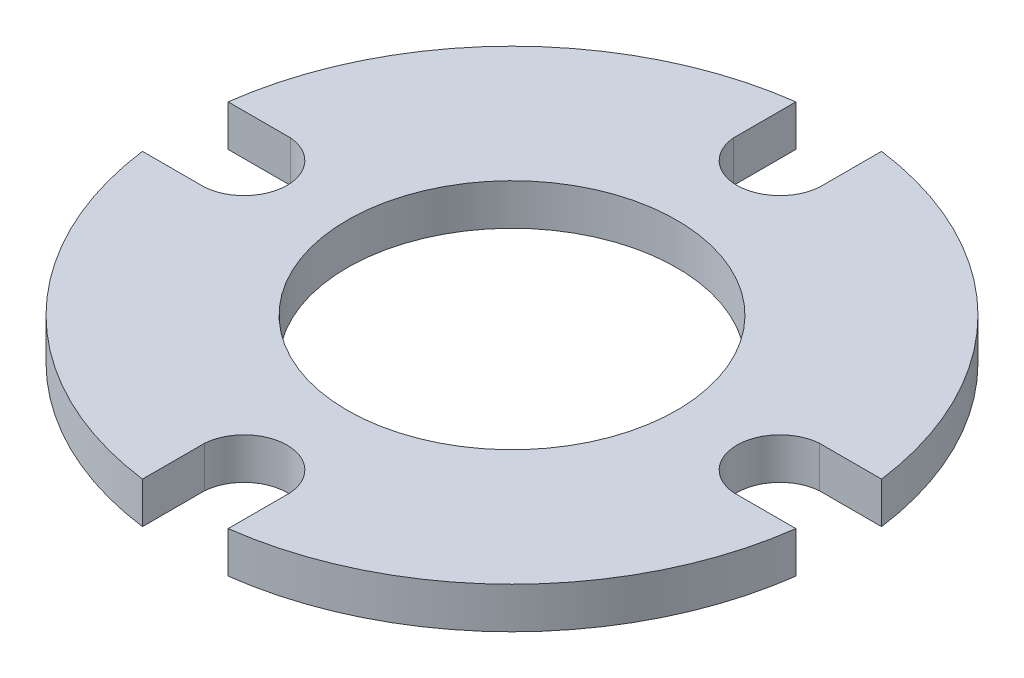
from build123d import *

# Parameters (mm, degrees)
SKETCH1_R           = 0.5
BOSS_EXTRUDE1_DEPTH = 0.125


with BuildPart() as part:
    # Sketch1 → Boss-Extrude1 (new body)
    with BuildSketch(Plane(origin=(0, 0, 0), x_dir=(1, 0, 0), z_dir=(0, 1, 0))):
        with BuildLine():
            Line((0.13, 0.991513994), (0.13, 0.802539096))
            ThreePointArc((0.13, 0.802539096), (0, 0.682579793), (-0.13, 0.802539096))
            Line((-0.13, 0.802539096), (-0.13, 0.991513994))
            ThreePointArc((-0.13, 0.991513994), (-0.707106781, 0.707106781), (-0.991513994, 0.13))
            Line((-0.991513994, 0.13), (-0.802539096, 0.13))
            ThreePointArc((-0.802539096, 0.13), (-0.682579793, 0), (-0.802539096, -0.13))
            Line((-0.802539096, -0.13), (-0.991513994, -0.13))
            ThreePointArc((-0.991513994, -0.13), (-0.707106781, -0.707106781), (-0.13, -0.991513994))
            Line((-0.13, -0.991513994), (-0.13, -0.802539096))
            ThreePointArc((-0.13, -0.802539096), (0, -0.682579793), (0.13, -0.802539096))
            Line((0.13, -0.802539096), (0.13, -0.991513994))
            ThreePointArc((0.13, -0.991513994), (0.707106781, -0.707106781), (0.991513994, -0.13))
            Line((0.991513994, -0.13), (0.802539096, -0.13))
            ThreePointArc((0.802539096, -0.13), (0.682579793, 0), (0.802539096, 0.13))
            Line((0.802539096, 0.13), (0.991513994, 0.13))
            ThreePointArc((0.991513994, 0.13), (0.707106781, 0.707106781), (0.13, 0.991513994))
        make_face()
        with Locations(Location((0, 0, 0), (0, 0, 270))):
            Circle(SKETCH1_R, mode=Mode.SUBTRACT)
    extrude(amount=BOSS_EXTRUDE1_DEPTH)


solid = part.part
